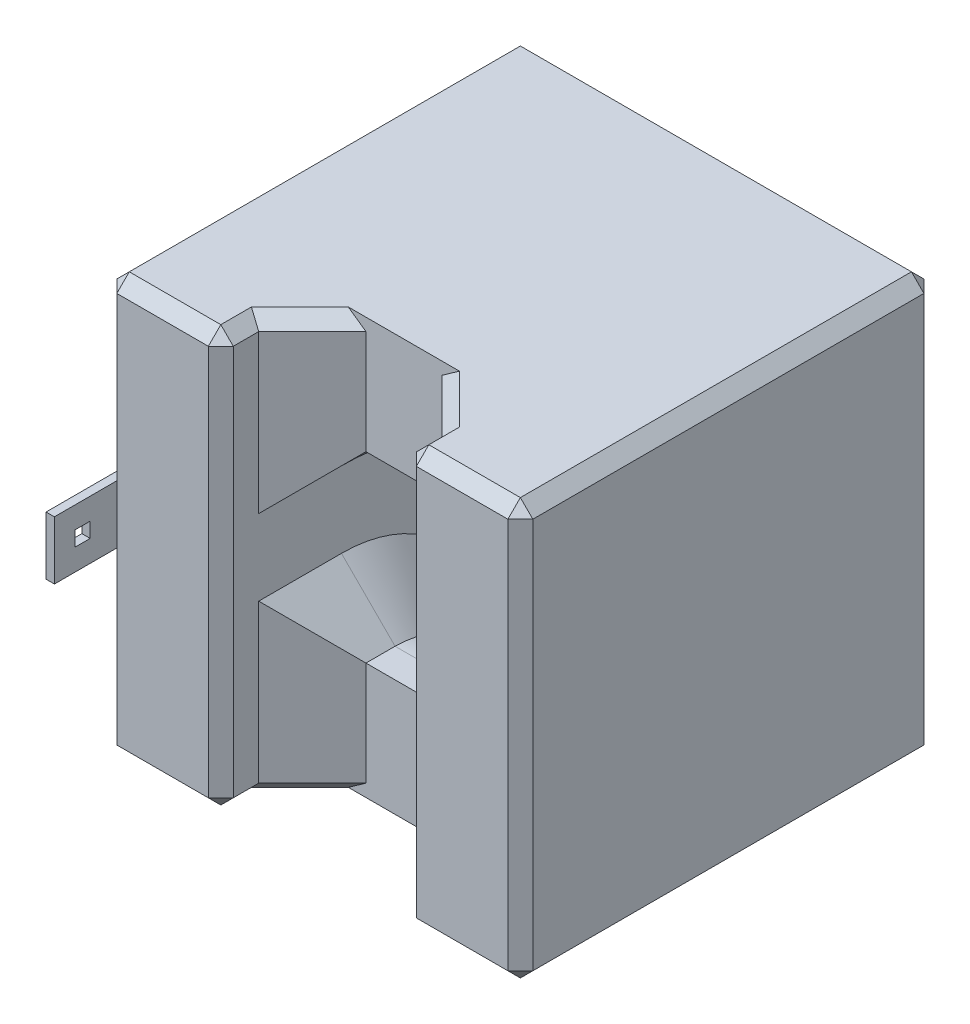
from build123d import *

# Parameters (mm, degrees)
SKETCH1_W                = 50
SKETCH1_H                = 50
BOSS_EXTRUDE1_DEPTH      = 50
CUT_EXTRUDE1_DEPTH       = 87.602540378
CHAMFER1_SIZE            = 1.5
BOSS_EXTRUDE2_DEPTH      = 7
BOSS_EXTRUDE2_DEPTH_BACK = 10
SKETCH5_W                = 1
SKETCH5_H                = 7
SKETCH6_W                = 1.8
SKETCH6_H                = 1.8
CUT_EXTRUDE2_DEPTH       = 7


with BuildPart() as part:
    # Sketch1 → Boss-Extrude1 (new body)
    with BuildSketch(Plane.XY):
        with Locations((25, 25)):
            Rectangle(SKETCH1_W, SKETCH1_H)
    extrude(amount=BOSS_EXTRUDE1_DEPTH)

    # Sketch2 → Cut-Extrude1 (cut, through all)
    with BuildSketch(Plane.XZ):
        Polygon((36, 45.443650814), (36, 54.556349186), (29.556349186, 61), (20.443650814, 61), (14, 54.556349186), (14, 45.443650814), (20.443650814, 39), (29.556349186, 39), align=None)
    extrude(amount=-CUT_EXTRUDE1_DEPTH, mode=Mode.SUBTRACT)

    # Cut-Sweep1: sweep along a path in Sketch4
    with BuildLine(Plane(origin=(25, 0, 0), x_dir=(0, 0, -1), z_dir=(1, 0, 0))) as cut_sweep1_path:
        Line((-13.5, 0), (-13.5, 3))
        ThreePointArc((-13.5, 3), (-19.943650814, 18.556349186), (-35.5, 25))
        Line((-35.5, 25), (-50, 25))
    # Sketch3 → Cut-Sweep1 (sweep, cut)
    with BuildSketch(Plane.XZ):
        Polygon((29.556349186, 24.5), (20.443650814, 24.5), (14, 18.056349186), (14, 8.943650814), (20.443650814, 2.5), (29.556349186, 2.5), (36, 8.943650814), (36, 18.056349186), align=None)
    sweep(path=cut_sweep1_path.line, mode=Mode.SUBTRACT)

    # Chamfer1
    chamfer1_edges = [part.edges().sort_by_distance(p)[0] for p in [
        (50, 25, 50),
        (43, 0, 50),
        (7, 50, 50),
        (36, 25, 50),
        (14, 25, 50),
        (14, 50, 47.721825407),
        (36, 50, 47.721825407),
        (36, 0, 47.721825407),
        (43, 50, 50),
        (14, 0, 47.721825407),
        (17.221825407, 0, 42.221825407),
        (32.778174593, 0, 42.221825407),
        (32.778174593, 50, 42.221825407),
        (17.221825407, 50, 42.221825407),
        (0, 25, 50),
        (25, 50, 0),
        (50, 25, 0),
        (25, 0, 0),
        (0, 25, 0),
        (7, 0, 50),
        (0, 50, 25),
        (50, 50, 25),
        (50, 0, 25),
        (0, 0, 25),
    ]]
    chamfer(chamfer1_edges, length=CHAMFER1_SIZE)

    # Sketch5 → Boss-Extrude2 (add, two sides: drawn at the far end of the back side and taken through both)
    with BuildSketch(Plane.XY.offset(50).offset(-BOSS_EXTRUDE2_DEPTH_BACK)):
        with Locations((0.5, 25)):
            Rectangle(SKETCH5_W, SKETCH5_H)
    extrude(amount=BOSS_EXTRUDE2_DEPTH + BOSS_EXTRUDE2_DEPTH_BACK)

    # Sketch6 → Cut-Extrude2 (cut)
    with BuildSketch(Plane(origin=(1, 0, 0), x_dir=(0, 0, -1), z_dir=(1, 0, 0))):
        with Locations((-53.6, 25)):
            Rectangle(SKETCH6_W, SKETCH6_H)
    extrude(amount=-CUT_EXTRUDE2_DEPTH, mode=Mode.SUBTRACT)


solid = part.part
